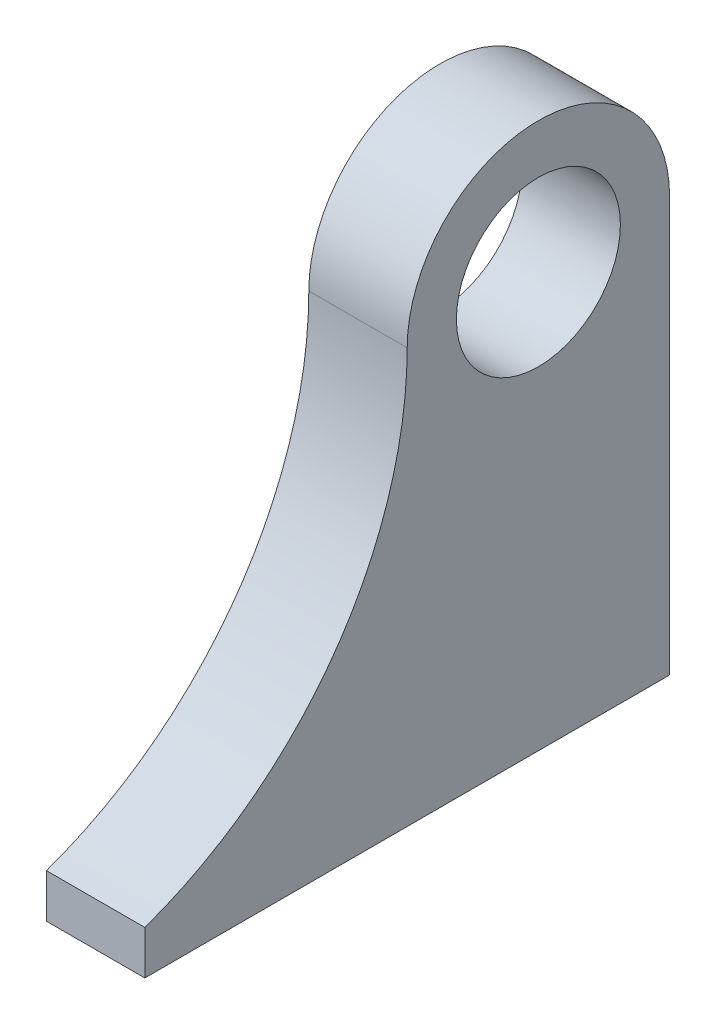
from build123d import *

# Parameters (mm, degrees)
CROQUIS1_W              = 4.7625
CROQUIS1_H              = 42.333333333
SALIENTE_EXTRUIR1_DEPTH = 26.416
CROQUIS2_R              = 3.96875
CORTAR_EXTRUIR1_DEPTH   = 25.4


with BuildPart() as part:
    # Croquis1 → Saliente-Extruir1 (new body)
    with BuildSketch(Plane(origin=(0, 0, 0), x_dir=(1, 0, 0), z_dir=(0, 1, 0))):
        with Locations((604.572916667, 432.985333334)):
            Rectangle(CROQUIS1_W, CROQUIS1_H)
    extrude(amount=SALIENTE_EXTRUIR1_DEPTH)

    # Croquis2 → Cortar-Extruir1 (cut)
    with BuildSketch(Plane(origin=(606.954166667, 0, 0), x_dir=(0, 0, -1), z_dir=(1, 0, 0))):
        with BuildLine():
            ThreePointArc((426.635333333, 20.066), (428.495205273, 24.556128061), (432.985333333, 26.416))
            Line((432.985333333, 26.416), (411.818666667, 26.416))
            Line((411.818666667, 26.416), (411.818666667, 0))
            Line((411.818666667, 0), (413.935333333, 0))
            Line((413.935333333, 0), (413.935333333, 2.12))
            ThreePointArc((413.935333333, 2.12), (423.139169599, 9.073401172), (426.635333333, 20.066))
        make_face()
        with BuildLine():
            ThreePointArc((432.985333333, 26.416), (437.475461394, 24.556128061), (439.335333333, 20.066))
            Line((439.335333333, 20.066), (439.335333333, 0))
            Line((439.335333333, 0), (454.152, 0))
            Line((454.152, 0), (454.152, 26.416))
            Line((454.152, 26.416), (432.985333333, 26.416))
        make_face()
        with Locations((432.985333333, 20.066)):
            Circle(CROQUIS2_R)
    extrude(amount=-CORTAR_EXTRUIR1_DEPTH, mode=Mode.SUBTRACT)


solid = part.part
